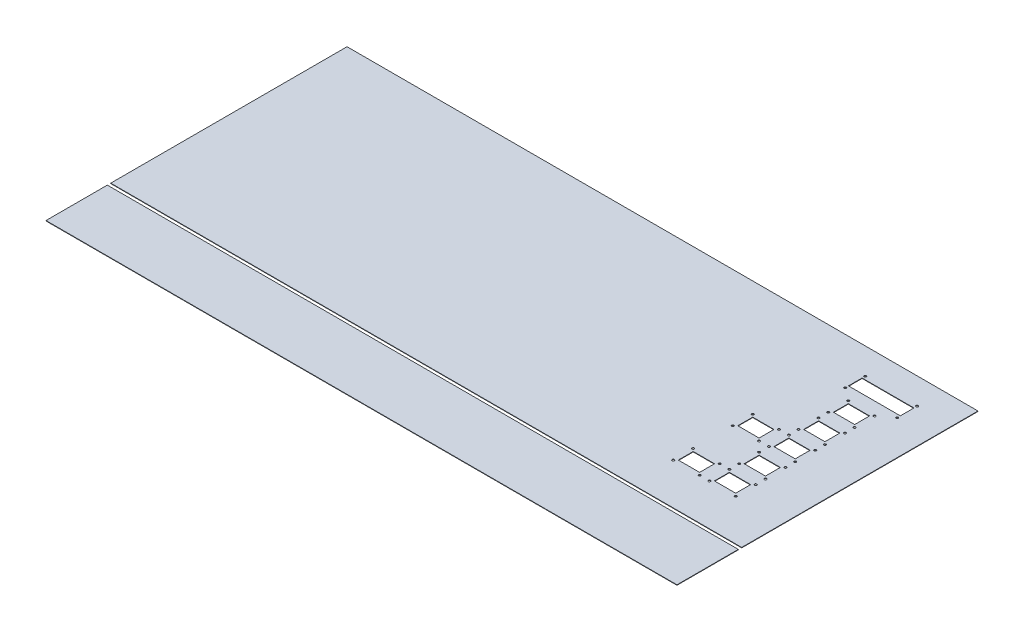
from build123d import *

# Parameters (mm, degrees)
BOSS_EXTRUDE1_DEPTH             = 0.508
BOSS_EXTRUDE1_DEPTH_BACK        = 0.508
SKETCH1_W                       = 1473.2
SKETCH1_H                       = 544.2
BOSS_EXTRUDE1_2_DEPTH           = 0.508
BOSS_EXTRUDE1_2_DEPTH_BACK      = 0.508
SKETCH1_H_2                     = 132.4
BOSS_EXTRUDE2_REACH             = 816.796
SKETCH2_W                       = 1485.2
SKETCH2_H                       = 556.2
SKETCH2_W_2                     = 1473.2
SKETCH2_H_2                     = 544.2
SKETCH2_H_3                     = 144.4
SKETCH2_H_4                     = 132.4
BOSS_EXTRUDE2_DIRECTION_2_REACH = 816.796
SKETCH3_R                       = 2.6
SKETCH3_W                       = 50.1
SKETCH3_H                       = 35.1
CUT_EXTRUDE1_DEPTH              = 823.790075332
LPATTERN1_COUNT                 = 5
LPATTERN1_PITCH                 = 70
LPATTERN1_COUNT_DIR2            = 2
LPATTERN1_PITCH_DIR2            = 85
CUT_EXTRUDE2_DEPTH              = 823.790075332
CUT_EXTRUDE2_DEPTH_BACK         = 823.790075332
SKETCH4_R                       = 2.6
SKETCH4_W                       = 122.1
SKETCH4_H                       = 32.1


with BuildPart() as part:
    # Sketch1 → Boss-Extrude1 (new, two sides: drawn at the far end of the back side and taken through both)
    with BuildSketch(Plane(origin=(0, 0, 0), x_dir=(1, 0, 0), z_dir=(0, 1, 0)).offset(-BOSS_EXTRUDE1_DEPTH_BACK)):
        with Locations((0, 76.2)):
            Rectangle(SKETCH1_W, SKETCH1_H)
    extrude(amount=BOSS_EXTRUDE1_DEPTH + BOSS_EXTRUDE1_DEPTH_BACK)

    # Boss-Extrude2: up to this face of the body (flat: up to its plane)
    boss_extrude2_end = Plane(part.part.faces().sort_by_distance((0, 0.508, -76.2))[0])
    # Sketch2 → Boss-Extrude2 (add, up to the picked face)
    with BuildSketch(Plane(origin=(0, 0, 0), x_dir=(1, 0, 0), z_dir=(0, 1, 0)), mode=Mode.PRIVATE) as boss_extrude2_sk1:
        with Locations((0, 76.2)):
            Rectangle(SKETCH2_W, SKETCH2_H)
        with Locations((0, 76.2)):
            Rectangle(SKETCH2_W_2, SKETCH2_H_2, mode=Mode.SUBTRACT)
    boss_extrude2_tool1 = split(extrude(boss_extrude2_sk1.sketch, amount=BOSS_EXTRUDE2_REACH, mode=Mode.PRIVATE), bisect_by=boss_extrude2_end, keep=Keep.BOTH, mode=Mode.PRIVATE)
    # Sketch2 → Boss-Extrude2 (add, up to the picked face)
    with BuildSketch(Plane(origin=(0, 0, 0), x_dir=(1, 0, 0), z_dir=(0, 1, 0)), mode=Mode.PRIVATE) as boss_extrude2_sk2:
        with Locations((0, -282.1)):
            Rectangle(SKETCH2_W, SKETCH2_H_3)
        with Locations((0, -282.1)):
            Rectangle(SKETCH2_W_2, SKETCH2_H_4, mode=Mode.SUBTRACT)
    boss_extrude2_tool2 = split(extrude(boss_extrude2_sk2.sketch, amount=BOSS_EXTRUDE2_REACH, mode=Mode.PRIVATE), bisect_by=boss_extrude2_end, keep=Keep.BOTH, mode=Mode.PRIVATE)


with BuildPart() as body_2:
    # Sketch1 → Boss-Extrude1 2 (new, two sides: drawn at the far end of the back side and taken through both)
    with BuildSketch(Plane(origin=(0, 0, 0), x_dir=(1, 0, 0), z_dir=(0, 1, 0)).offset(-BOSS_EXTRUDE1_2_DEPTH_BACK)):
        with Locations((0, -282.1)):
            Rectangle(SKETCH1_W, SKETCH1_H_2)
    extrude(amount=BOSS_EXTRUDE1_2_DEPTH + BOSS_EXTRUDE1_2_DEPTH_BACK)


with BuildPart() as part_1:
    add(part.part)

    add(body_2.part)  # Boss-Extrude2 merges body 2
    add(boss_extrude2_tool1.solids().sort_by(Axis((0, 0, -352.714069), (0, 1, 0)))[0])
    add(boss_extrude2_tool2.solids().sort_by(Axis((0, 0, 352.807797), (0, 1, 0)))[0])

    # Boss-Extrude2 direction 2: up to this face of the body (flat: up to its plane)
    boss_extrude2_direction_2_end = Plane(part_1.part.faces().sort_by_distance((0, -0.508, -76.2))[0])
    # Sketch2 → Boss-Extrude2 direction 2 (add, up to the picked face)
    with BuildSketch(Plane(origin=(0, 0, 0), x_dir=(1, 0, 0), z_dir=(0, 1, 0)), mode=Mode.PRIVATE) as boss_extrude2_direction_2_sk1:
        with Locations((0, 76.2)):
            Rectangle(SKETCH2_W, SKETCH2_H)
        with Locations((0, 76.2)):
            Rectangle(SKETCH2_W_2, SKETCH2_H_2, mode=Mode.SUBTRACT)
    boss_extrude2_direction_2_tool1 = split(extrude(boss_extrude2_direction_2_sk1.sketch, amount=-BOSS_EXTRUDE2_DIRECTION_2_REACH, mode=Mode.PRIVATE), bisect_by=boss_extrude2_direction_2_end, keep=Keep.BOTH, mode=Mode.PRIVATE)
    # Sketch2 → Boss-Extrude2 direction 2 (add, up to the picked face)
    with BuildSketch(Plane(origin=(0, 0, 0), x_dir=(1, 0, 0), z_dir=(0, 1, 0)), mode=Mode.PRIVATE) as boss_extrude2_direction_2_sk2:
        with Locations((0, -282.1)):
            Rectangle(SKETCH2_W, SKETCH2_H_3)
        with Locations((0, -282.1)):
            Rectangle(SKETCH2_W_2, SKETCH2_H_4, mode=Mode.SUBTRACT)
    boss_extrude2_direction_2_tool2 = split(extrude(boss_extrude2_direction_2_sk2.sketch, amount=-BOSS_EXTRUDE2_DIRECTION_2_REACH, mode=Mode.PRIVATE), bisect_by=boss_extrude2_direction_2_end, keep=Keep.BOTH, mode=Mode.PRIVATE)
    add(boss_extrude2_direction_2_tool1.solids().sort_by(Axis((0, 0, -352.714069), (0, -1, 0)))[0])
    add(boss_extrude2_direction_2_tool2.solids().sort_by(Axis((0, 0, 352.807797), (0, -1, 0)))[0])

    # Sketch3 → Cut-Extrude1 (cut, symmetric)
    with BuildSketch(Plane(origin=(0, 0, 0), x_dir=(1, 0, 0), z_dir=(0, 1, 0))):
        with Locations((568.95, -104.45)):
            Circle(SKETCH3_R)
        with Locations((631.05, -104.45)):
            Circle(SKETCH3_R)
        with Locations((631.05, -57.35)):
            Circle(SKETCH3_R)
        with Locations((568.95, -57.35)):
            Circle(SKETCH3_R)
        with Locations((600, -80.9)):
            Rectangle(SKETCH3_W, SKETCH3_H)
    cut_extrude1 = extrude(amount=CUT_EXTRUDE1_DEPTH, both=True, mode=Mode.SUBTRACT)

    # LPattern1: Cut-Extrude1 5 × 2, 3 skipped
    with Locations(*[(-j * LPATTERN1_PITCH_DIR2, 0, -i * LPATTERN1_PITCH) for i in range(LPATTERN1_COUNT) for j in range(LPATTERN1_COUNT_DIR2) if (i, j) not in ((0, 0), (1, 1), (3, 1), (4, 1))]):
        add(cut_extrude1, mode=Mode.SUBTRACT)

    # Sketch4 → Cut-Extrude2 (cut, two sides: drawn at the far end of the back side and taken through both)
    with BuildSketch(Plane(origin=(0, 0, 0), x_dir=(1, 0, 0), z_dir=(0, 1, 0)).offset(-CUT_EXTRUDE2_DEPTH_BACK)):
        with Locations((661.05, 245.55)):
            Circle(SKETCH4_R)
        with Locations((661.05, 292.65)):
            Circle(SKETCH4_R)
        with Locations((538.95, 245.55)):
            Circle(SKETCH4_R)
        with Locations((538.95, 292.65)):
            Circle(SKETCH4_R)
        with Locations((600, 269.1)):
            Rectangle(SKETCH4_W, SKETCH4_H)
    extrude(amount=CUT_EXTRUDE2_DEPTH + CUT_EXTRUDE2_DEPTH_BACK, mode=Mode.SUBTRACT)


solid = part_1.part
